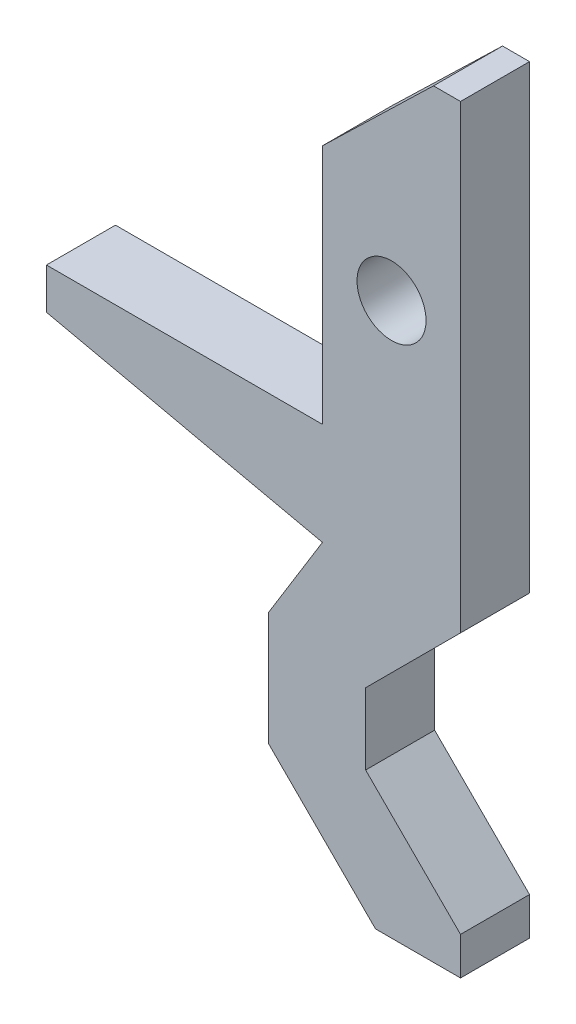
from build123d import *

# Parameters (mm, degrees)
SKETCH_1_R      = 5
SKETCH_1_R_2    = 2.5
EXTRUDE_1_DEPTH = 5


with BuildPart() as part:
    # 스케치1 → 보스-돌출1 (new body)
    # profile 1 of 3: a face of its own
    with BuildSketch(Plane.XY):
        with BuildLine():
            ThreePointArc((-5, 0), (0, 5), (5, 0))
            Line((5, 0), (5, 15))
            Line((5, 15), (3.042493031, 15))
            Line((3.042493031, 15), (-5, 7.220187609))
            Line((-5, 7.220187609), (-5, 0))
        make_face()
    # profile 2 of 3: a face of its own
    with BuildSketch(Plane.XY):
        Circle(SKETCH_1_R)
        Circle(SKETCH_1_R_2, mode=Mode.SUBTRACT)
    # profile 3 of 3: a face of its own
    with BuildSketch(Plane.XY):
        with BuildLine():
            Line((5, -18.348194171), (5, 0))
            ThreePointArc((5, 0), (0, -5), (-5, 0))
            Line((-5, 0), (-4.999740664, -10.261800472))
            Line((-4.999740664, -10.261800472), (-25, -10.261800472))
            Line((-25, -10.261800472), (-25, -13.231879179))
            Line((-25, -13.231879179), (-5.003340767, -17.667219117))
            Line((-5.003340767, -17.667219117), (-8.918287267, -24.027561259))
            Line((-8.918287267, -24.027561259), (-8.918287267, -32.241958326))
            Line((-8.918287267, -32.241958326), (-1.160245593, -40))
            Line((-1.160245593, -40), (5, -40))
            Line((5, -40), (5, -37.263121262))
            Line((5, -37.263121262), (-1.875384477, -30.387736785))
            Line((-1.875384477, -30.387736785), (-1.875384477, -25.223578647))
            Line((-1.875384477, -25.223578647), (5, -18.348194171))
        make_face()
    extrude(amount=EXTRUDE_1_DEPTH)


solid = part.part
